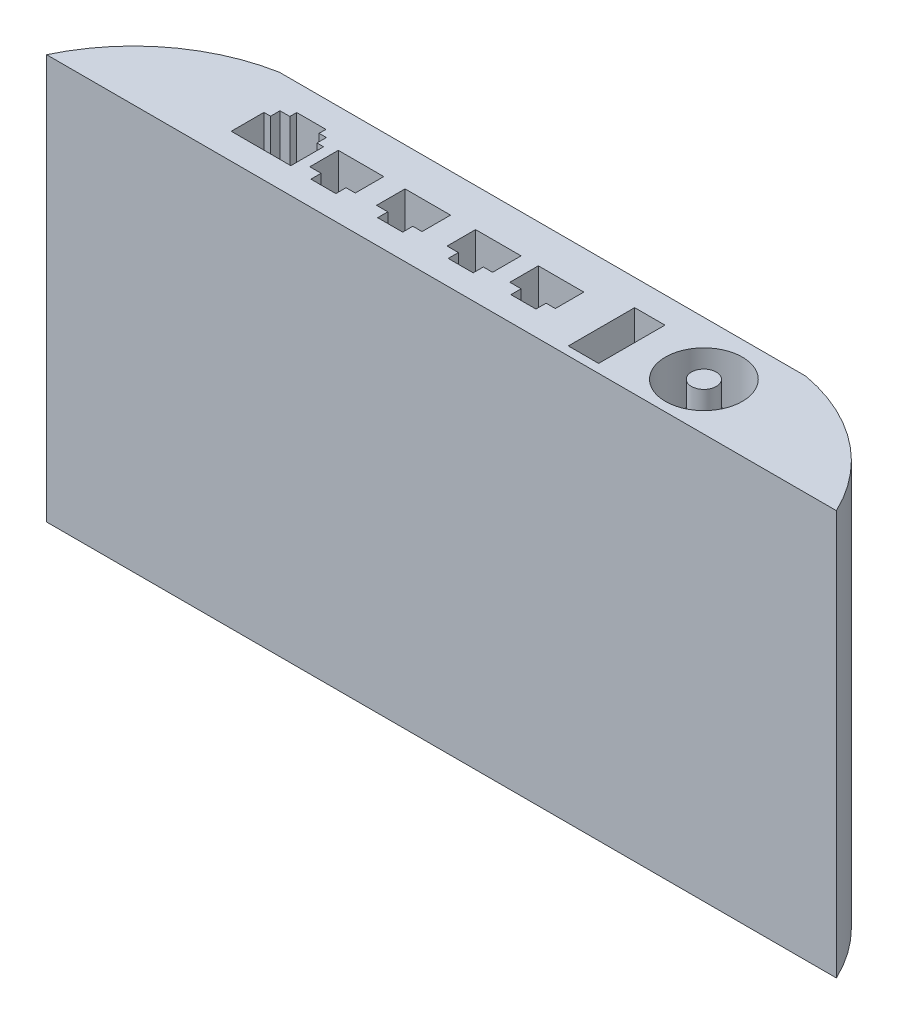
from build123d import *

# Parameters (mm, degrees)
BOSS_EXTRUDE1_DEPTH = 200
SKETCH2_R           = 19.005135809
SKETCH2_R_2         = 6.150490934
SKETCH2_W           = 14.963877837
SKETCH2_H           = 32.789303583
CUT_EXTRUDE1_DEPTH  = 25


with BuildPart() as part:
    # Sketch1 → Boss-Extrude1 (new body)
    with BuildSketch(Plane(origin=(0, 0, 0), x_dir=(1, 0, 0), z_dir=(0, 1, 0))):
        with BuildLine():
            Line((199.247825531, -25), (-191.027117423, -25))
            ThreePointArc((-191.027117423, -25), (-164.527287911, 7.845509301), (-125.968347388, 25))
            Line((-125.968347388, 25), (134.189055496, 25))
            ThreePointArc((134.189055496, 25), (172.747996019, 7.845509301), (199.247825531, -25))
        make_face()
    extrude(amount=BOSS_EXTRUDE1_DEPTH)

    # Sketch2 → Cut-Extrude1 (cut)
    # profile 1 of 7: a face of its own
    with BuildSketch(Plane(origin=(0, 200, 0), x_dir=(1, 0, 0), z_dir=(0, 1, 0))):
        with Locations(Location((110.270417857, -1.503200416, 0), (0, 0, 270))):
            Circle(SKETCH2_R)
        with Locations(Location((110.270417857, -1.503200416, 0), (0, 0, 270))):
            Circle(SKETCH2_R_2, mode=Mode.SUBTRACT)
    # profile 2 of 7: a face of its own
    with BuildSketch(Plane(origin=(0, 200, 0), x_dir=(1, 0, 0), z_dir=(0, 1, 0))):
        Polygon((-72.460343133, -7.946264371), (-78.025852291, -7.946264371), (-78.025852291, 6.139420836), (-55.550414196, 6.139420836), (-55.550414196, -7.946264371), (-60.107751805, -7.946264371), (-60.107751805, -12.97071102), (-72.460343133, -12.97071102), align=None)
    # profile 3 of 7: a face of its own
    with BuildSketch(Plane(origin=(0, 200, 0), x_dir=(1, 0, 0), z_dir=(0, 1, 0))):
        Polygon((-39.468323041, -7.946264371), (-45.033832199, -7.946264371), (-45.033832199, 6.139420836), (-22.558394104, 6.139420836), (-22.558394104, -7.946264371), (-27.115731714, -7.946264371), (-27.115731714, -12.97071102), (-39.468323041, -12.97071102), align=None)
    # profile 4 of 7: a face of its own
    with BuildSketch(Plane(origin=(0, 200, 0), x_dir=(1, 0, 0), z_dir=(0, 1, 0))):
        Polygon((-4.613365568, -7.946264371), (-10.178874726, -7.946264371), (-10.178874726, 6.139420836), (12.296563369, 6.139420836), (12.296563369, -7.946264371), (7.739225759, -7.946264371), (7.739225759, -12.97071102), (-4.613365568, -12.97071102), align=None)
    # profile 5 of 7: a face of its own
    with BuildSketch(Plane(origin=(0, 200, 0), x_dir=(1, 0, 0), z_dir=(0, 1, 0))):
        Polygon((26.395527633, -7.946264371), (20.830018475, -7.946264371), (20.830018475, 6.139420836), (43.30545657, 6.139420836), (43.30545657, -7.946264371), (38.74811896, -7.946264371), (38.74811896, -12.97071102), (26.395527633, -12.97071102), align=None)
    # profile 6 of 7: a face of its own
    with BuildSketch(Plane(origin=(0, 200, 0), x_dir=(1, 0, 0), z_dir=(0, 1, 0))):
        Polygon((-83.179668167, -12.163715332), (-83.179668167, 4.015448284), (-86.438780262, 4.015448284), (-86.438780262, 8.671322706), (-90.047082939, 8.671322706), (-90.047082939, 12.046831662), (-104.480293646, 12.046831662), (-104.480293646, 8.671322706), (-109.368961789, 8.671322706), (-109.368961789, 4.015448284), (-112.628073884, 4.015448284), (-112.628073884, -12.163715332), align=None)
    # profile 7 of 7: a face of its own
    with BuildSketch(Plane(origin=(0, 200, 0), x_dir=(1, 0, 0), z_dir=(0, 1, 0))):
        with Locations((70.010460819, -4.347820129)):
            Rectangle(SKETCH2_W, SKETCH2_H)
    extrude(amount=-CUT_EXTRUDE1_DEPTH, mode=Mode.SUBTRACT)


solid = part.part
